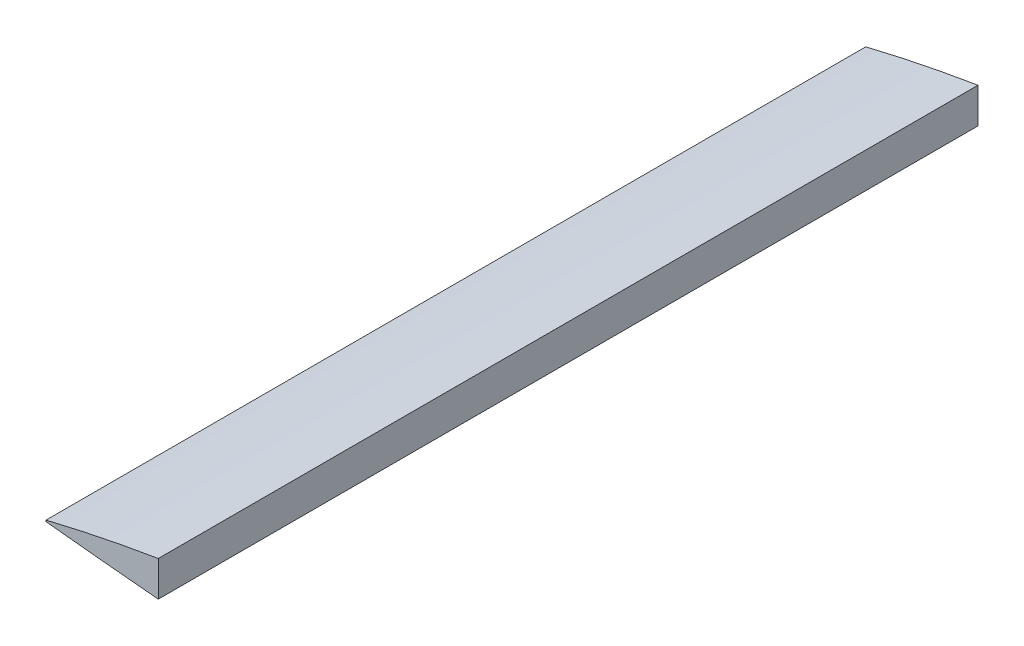
from build123d import *

# Parameters (mm, degrees)
BOSS_EXTRUDE1_DEPTH = 612
SKETCH2_W           = 21
SKETCH2_H           = 11.5
CUT_EXTRUDE1_DEPTH  = 13


with BuildPart() as part:
    # Sketch1 → Boss-Extrude1 (new body)
    with BuildSketch(Plane.XY):
        with BuildLine():
            Line((-238.52642, 17.587837008), (-238.52642, -8.716692608))
            add(Edge.make_bspline(
                [(-238.52642, -8.716692608), (-240.645712689, -8.524566336), (-246.278870054, -8.013887689), (-255.233473928, -7.18185892), (-265.178981162, -6.244995156), (-274.489440352, -5.352918296), (-283.105667881, -4.514534117), (-290.972478701, -3.737166797), (-298.039247243, -3.028597664), (-304.260184656, -2.395334726), (-309.594932864, -1.846814637), (-314.008232694, -1.382760705), (-317.472079994, -1.027677659), (-319.961203892, -0.741044399), (-321.464120443, -0.620061141), (-322.14198951, -0.505870173), (-322.321741193, -0.506509982), (-322.333, -0.506550056)],
                knots=[0, 0, 0, 0, 0.075810952, 0.201508279, 0.320388141, 0.43169539, 0.534719075, 0.628797147, 0.713321079, 0.787740393, 0.851567051, 0.904379655, 0.945827345, 0.975633259, 0.993597432, 0.999598973, 1, 1, 1, 1], degree=3))
            Line((-322.333, -0.506550056), (-322.333, 0.514797488))
            add(Edge.make_bspline(
                [(-238.52642, 17.587837008), (-240.97409295, 17.181883875), (-246.929768524, 16.194119087), (-256.181161896, 14.546071568), (-266.070660074, 12.709259674), (-275.306483123, 10.911648489), (-283.834265101, 9.183942037), (-291.603292923, 7.551124985), (-298.5678643, 6.038775613), (-304.687234381, 4.671057654), (-309.925850127, 3.470601465), (-314.253461718, 2.457844812), (-317.645235976, 1.650544322), (-320.081782459, 1.063070487), (-321.538022536, 0.709024901), (-322.180548986, 0.552044036), (-322.333, 0.514797488)],
                knots=[0, 0, 0, 0, 0.087007005, 0.211705365, 0.329527113, 0.439740645, 0.541660709, 0.634652346, 0.718134669, 0.791584505, 0.854539888, 0.906603358, 0.947445002, 0.976805146, 0.994496602, 1, 1, 1, 1], degree=3))
        make_face()
    extrude(amount=BOSS_EXTRUDE1_DEPTH)

    # Sketch2 → Cut-Extrude1 (cut)
    with BuildSketch(Plane.XY.offset(83.9)):
        with Locations((-251.75, -3.34)):
            Rectangle(SKETCH2_W, SKETCH2_H)
    extrude(amount=CUT_EXTRUDE1_DEPTH, mode=Mode.SUBTRACT)


solid = part.part
